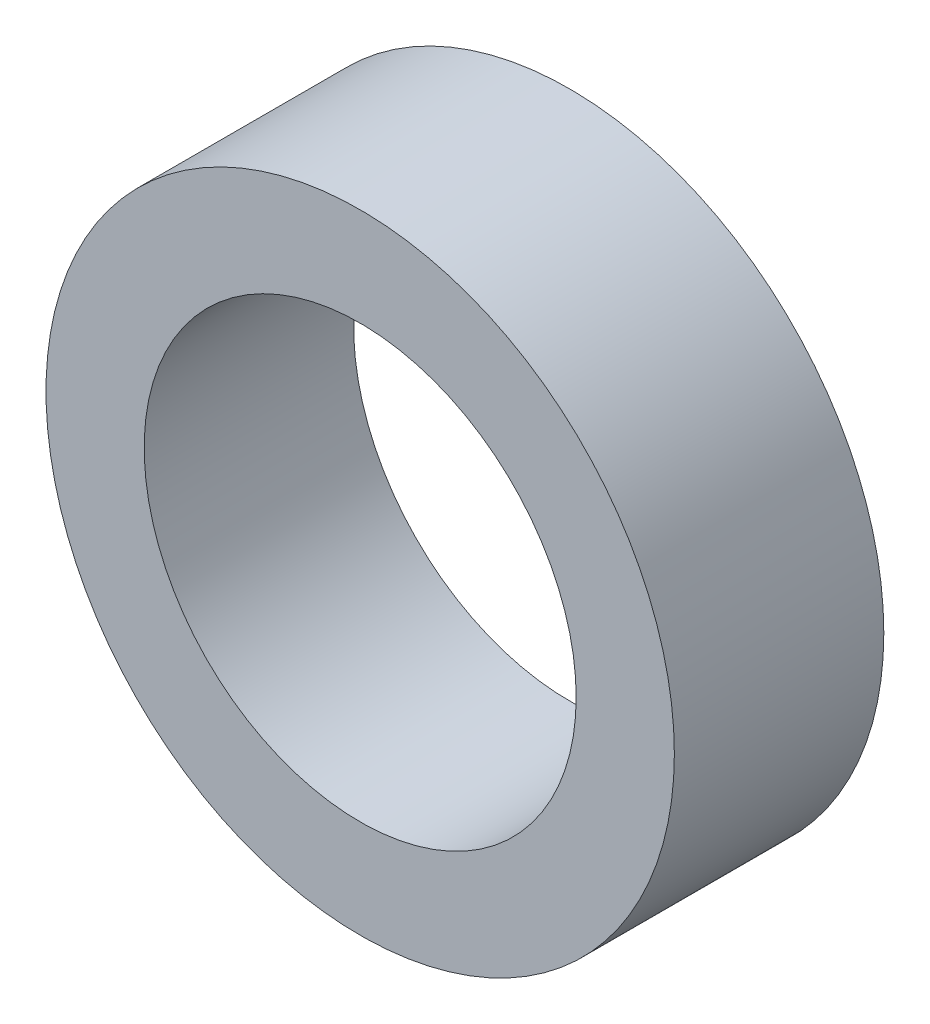
from build123d import *

# Parameters (mm, degrees)
SKETCH1_R           = 6
SKETCH1_R_2         = 4.125
BOSS_EXTRUDE1_DEPTH = 4


with BuildPart() as part:
    # Sketch1 → Boss-Extrude1 (new body)
    with BuildSketch(Plane.XY):
        with Locations((-32.158521212, 7.929280564)):
            Circle(SKETCH1_R)
        with Locations((-32.158521212, 7.929280564)):
            Circle(SKETCH1_R_2, mode=Mode.SUBTRACT)
    extrude(amount=BOSS_EXTRUDE1_DEPTH)


solid = part.part
